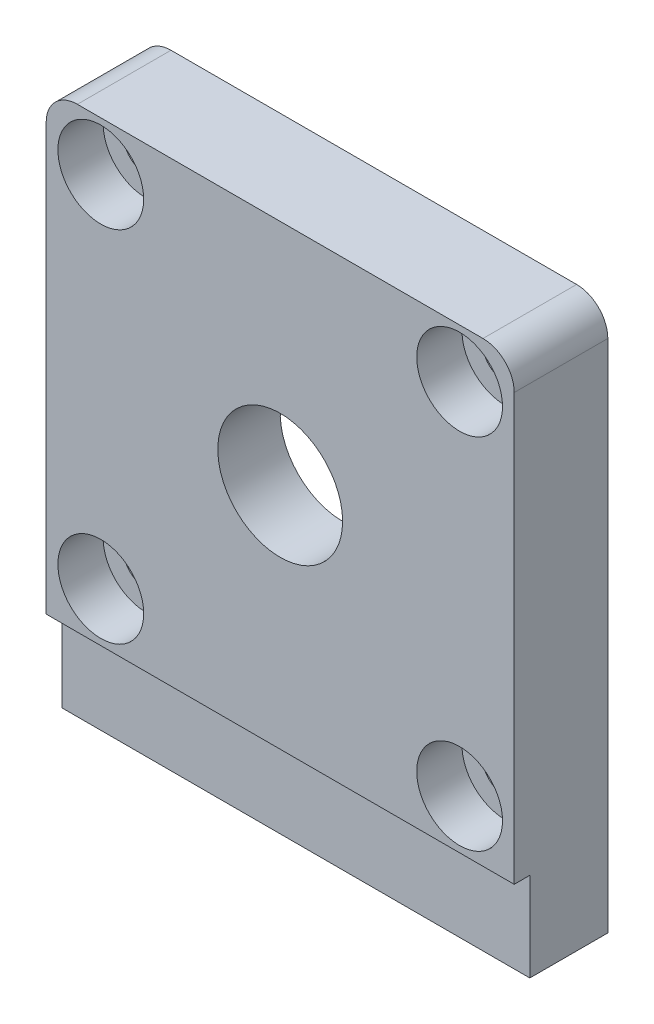
from build123d import *

# Parameters (mm, degrees)
BODY_DEPTH               = 30
FIXTURE_M2_5_D           = 2.9
FIXTURE_M2_5_DEPTH       = 6
FIXTURE_M2_5_CBORE_D     = 5.5
FIXTURE_M2_5_CBORE_DEPTH = 2.9
FIXTURE_M2_5_TIP         = 0.871247898
SKETCH_5_R               = 4
CUT_EXTRUDE_1_DEPTH      = 6
SKETCH_6_R               = 11
CUT_EXTRUDE_2_DEPTH      = 2
FILLET_1_R               = 2


with BuildPart() as part:
    # Эскиз1 → Body (new body)
    with BuildSketch(Plane.ZY.offset(15)):
        Polygon((1, 2.7), (1, 32), (-5, 32), (-5, -3), (0, -3), (0, 2.7), align=None)
    extrude(amount=-BODY_DEPTH)

    # Fixture M2.5
    with Locations(Plane(origin=(-11.5, 28.85, 1), x_dir=(1, 0, 0), z_dir=(0, 0, 1))):
        with Locations((0, 0), (23, 0), (23, -23), (0, -23)):
            CounterBoreHole(FIXTURE_M2_5_D / 2, FIXTURE_M2_5_CBORE_D / 2, FIXTURE_M2_5_CBORE_DEPTH, depth=FIXTURE_M2_5_DEPTH)
            with Locations((0, 0, -(FIXTURE_M2_5_DEPTH + FIXTURE_M2_5_TIP / 2))):  # 118° drill point
                Cone(0, FIXTURE_M2_5_D / 2, FIXTURE_M2_5_TIP, mode=Mode.SUBTRACT)

    # Эскиз5 → Вырез-Вытянуть1 (cut)
    with BuildSketch(Plane.XY.offset(1)):
        with Locations((0, 17.35)):
            Circle(SKETCH_5_R)
    extrude(amount=-CUT_EXTRUDE_1_DEPTH, mode=Mode.SUBTRACT)

    # Эскиз6 → Вырез-Вытянуть2 (cut)
    with BuildSketch(Plane(origin=(0, 0, -5), x_dir=(-1, 0, 0), z_dir=(0, 0, -1))):
        with Locations(Location((0, 17.35, 0), (0, 0, 90))):
            Circle(SKETCH_6_R)
    extrude(amount=-CUT_EXTRUDE_2_DEPTH, mode=Mode.SUBTRACT)

    # Скругление1
    fillet_1_edges = [part.edges().sort_by_distance(p)[0] for p in [
        (15, 32, -2),
        (-15, 32, -2),
    ]]
    fillet(fillet_1_edges, radius=FILLET_1_R)


solid = part.part
